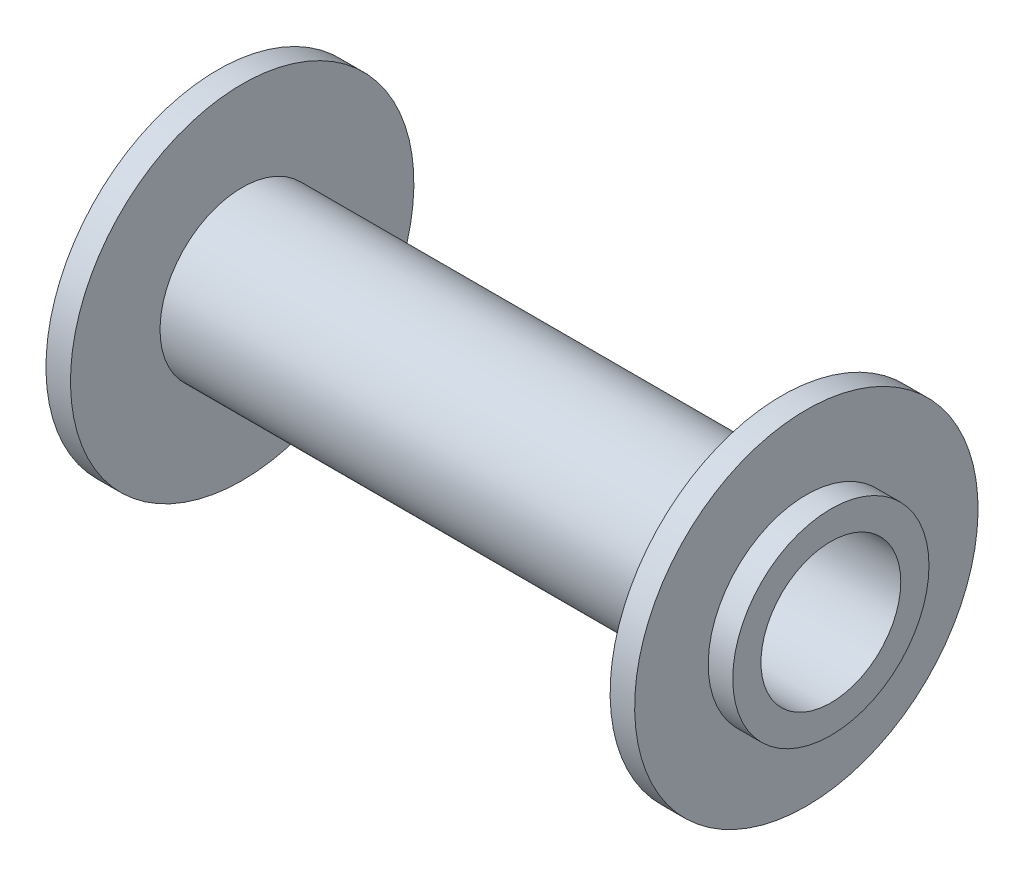
from build123d import *

# Parameters (mm, degrees)
SKETCH2_R           = 5.7
CUT_EXTRUDE1_DEPTH  = 52.923019943
BOSS_EXTRUDE1_START = 2
SKETCH3_R           = 8
SKETCH3_R_2         = 5.7
BOSS_EXTRUDE1_DEPTH = 2
SKETCH4_R           = 8
SKETCH4_R_2         = 5.7
BOSS_EXTRUDE2_DEPTH = 2


with BuildPart() as part:
    # Sketch1 → Revolve1 (revolve)
    with BuildSketch(Plane.XY, mode=Mode.PRIVATE) as revolve1_sk:
        Polygon((-24, 0), (24, 0), (24, 14), (22, 14), (22, 6.7), (-22, 6.7), (-22, 14), (-24, 14), align=None)
    revolve(revolve1_sk.sketch.rotate(Axis((-24, 0, 0), (1, 0, 0)), 180), axis=Axis((-24, 0, 0), (1, 0, 0)))

    # Sketch2 → Cut-Extrude1 (cut, through all)
    with BuildSketch(Plane(origin=(24, 0, 0), x_dir=(0, 0, -1), z_dir=(1, 0, 0))):
        Circle(SKETCH2_R)
    extrude(amount=-CUT_EXTRUDE1_DEPTH, mode=Mode.SUBTRACT)

    # Sketch3 → Boss-Extrude1 (add)
    with BuildSketch(Plane(origin=(24, 0, 0), x_dir=(0, 0, -1), z_dir=(1, 0, 0)).offset(BOSS_EXTRUDE1_START)):
        with Locations(Location((0, 0, 0), (0, 0, 270))):
            Circle(SKETCH3_R)
        Circle(SKETCH3_R_2, mode=Mode.SUBTRACT)
    extrude(amount=-BOSS_EXTRUDE1_DEPTH)

    # Sketch4 → Boss-Extrude2 (add)
    with BuildSketch(Plane.ZY.offset(24)):
        with Locations(Location((0, 0, 0), (0, 0, 270))):
            Circle(SKETCH4_R)
        with Locations(Location((0, 0, 0), (0, 0, 180))):
            Circle(SKETCH4_R_2, mode=Mode.SUBTRACT)
    extrude(amount=BOSS_EXTRUDE2_DEPTH)


solid = part.part
